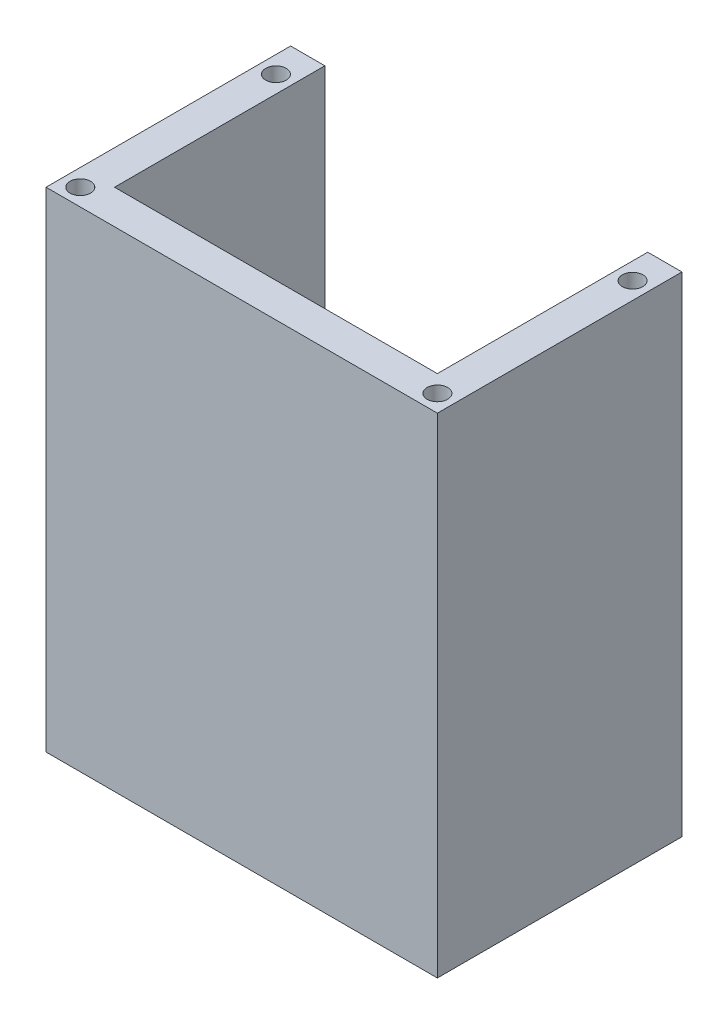
from build123d import *

# Parameters (mm, degrees)
SKETCH_1_W          = 80
SKETCH_1_H          = 50
EXTRUDE_1_DEPTH     = 100
SKETCH_3_W          = 66
SKETCH_3_H          = 44.469830213
CUT_EXTRUDE_1_DEPTH = 138.477270849
SKETCH_4_R          = 2.1
CUT_EXTRUDE_2_DEPTH = 138.477270849


with BuildPart() as part:
    # 草圖1 → 填料-伸長1 (new body)
    with BuildSketch(Plane(origin=(0, 0, 0), x_dir=(1, 0, 0), z_dir=(0, 1, 0))):
        with Locations((40, 25)):
            Rectangle(SKETCH_1_W, SKETCH_1_H)
    extrude(amount=EXTRUDE_1_DEPTH)

    # 草圖3 → 除料-伸長1 (cut, through all)
    with BuildSketch(Plane(origin=(0, 0, 0), x_dir=(1, 0, 0), z_dir=(0, 1, 0))):
        with Locations((40, 29.234915107)):
            Rectangle(SKETCH_3_W, SKETCH_3_H)
    extrude(amount=CUT_EXTRUDE_1_DEPTH, mode=Mode.SUBTRACT)

    # 草圖4 → 除料-伸長2 (cut, through all)
    with BuildSketch(Plane(origin=(0, 0, 0), x_dir=(1, 0, 0), z_dir=(0, 1, 0))):
        with Locations(Location((3.5, 3.5, 0), (0, 0, 270))):
            Circle(SKETCH_4_R)
        with Locations(Location((3.5, 43.5, 0), (0, 0, 270))):
            Circle(SKETCH_4_R)
        with Locations(Location((76.5, 43.4, 0), (0, 0, 270))):
            Circle(SKETCH_4_R)
        with Locations(Location((76.5, 3.5, 0), (0, 0, 270))):
            Circle(SKETCH_4_R)
    extrude(amount=CUT_EXTRUDE_2_DEPTH, mode=Mode.SUBTRACT)


solid = part.part
